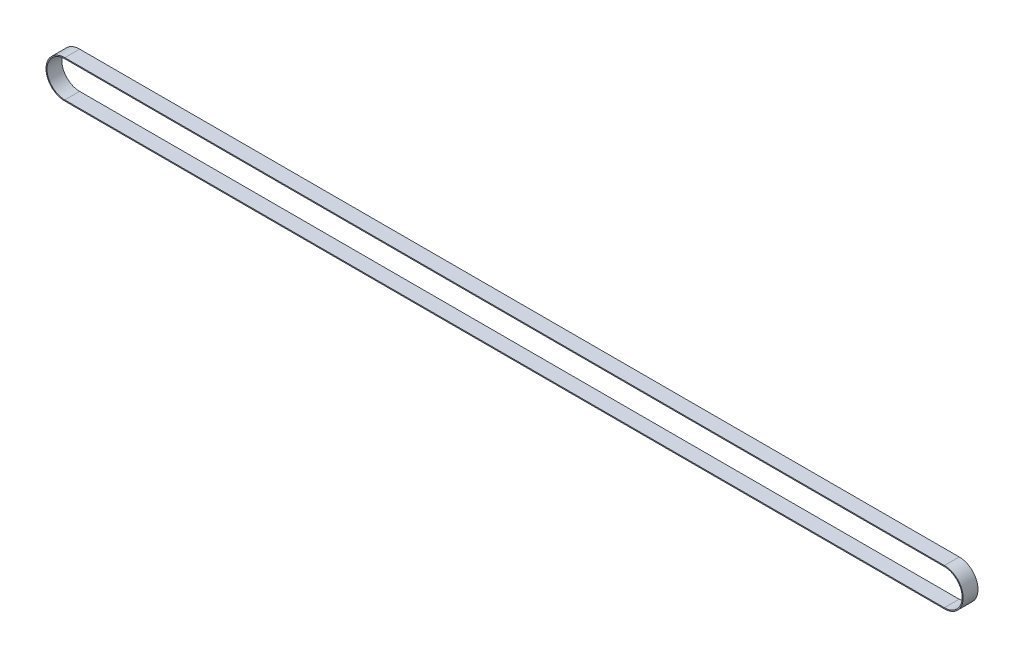
from build123d import *

# Parameters (mm, degrees)
EXTRUDE_1_DEPTH = 15


with BuildPart() as part:
    # 草图1 → 凸台-拉伸1 (new body)
    with BuildSketch(Plane.XY):
        with BuildLine():
            Line((0, -19), (889, -19))
            ThreePointArc((889, -19), (908, 0), (889, 19))
            Line((889, 19), (0, 19))
            ThreePointArc((0, 19), (-19, 0), (0, -19))
        make_face()
        with BuildLine():
            Line((889, 18), (0, 18))
            ThreePointArc((0, 18), (-18, 0), (0, -18))
            Line((0, -18), (889, -18))
            ThreePointArc((889, -18), (907, 0), (889, 18))
        make_face(mode=Mode.SUBTRACT)
    extrude(amount=EXTRUDE_1_DEPTH)


solid = part.part
